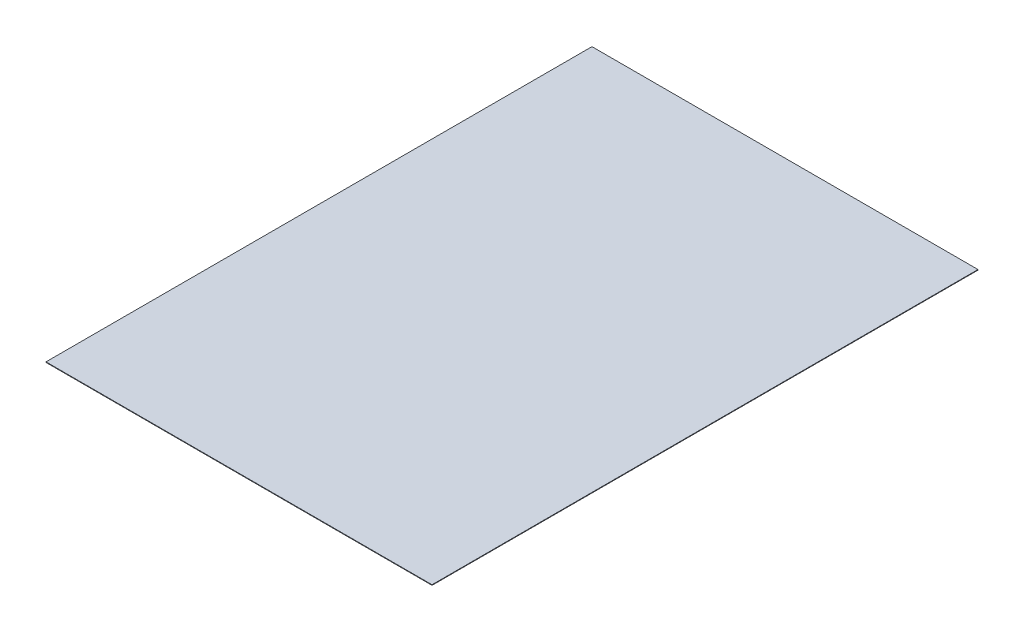
from build123d import *

# Parameters (mm, degrees)
SKETCH1_W           = 210
SKETCH1_H           = 297
BOSS_EXTRUDE1_DEPTH = 0.3


with BuildPart() as part:
    # Sketch1 → Boss-Extrude1 (new body)
    with BuildSketch(Plane(origin=(0, 0, 0), x_dir=(1, 0, 0), z_dir=(0, 1, 0))):
        Rectangle(SKETCH1_W, SKETCH1_H)
    extrude(amount=BOSS_EXTRUDE1_DEPTH)


solid = part.part
